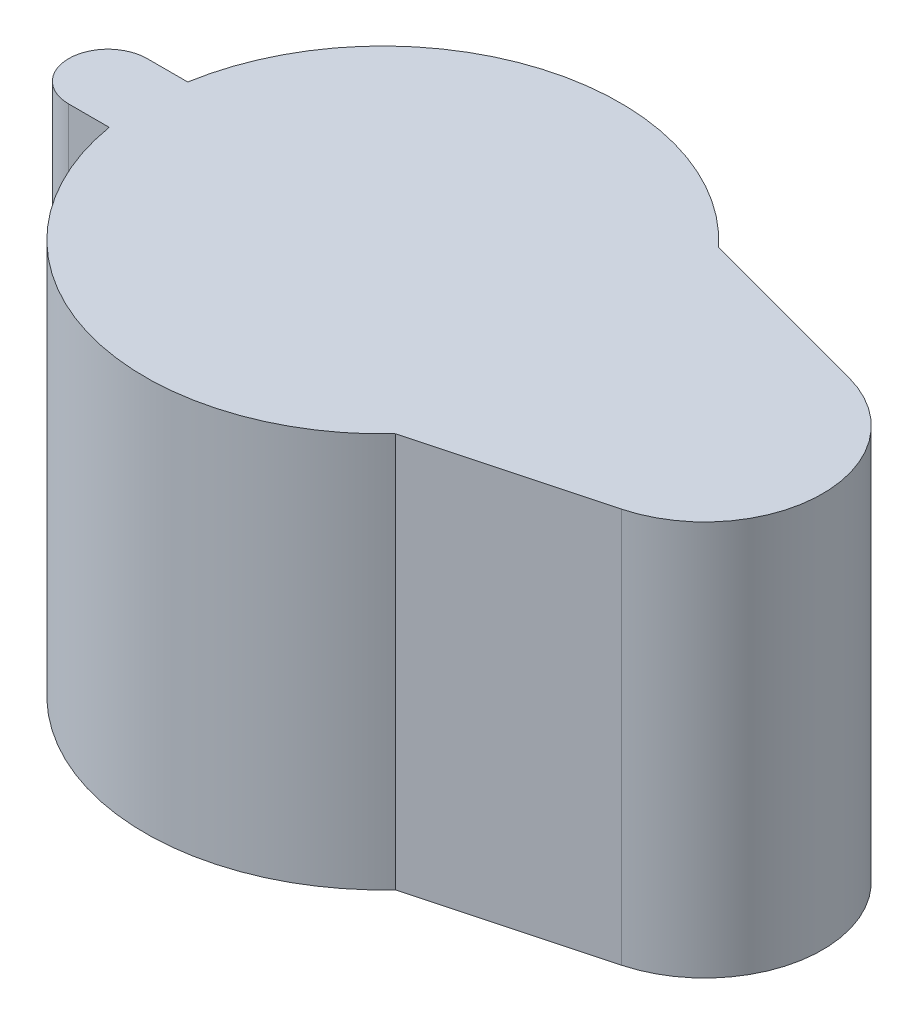
from build123d import *

# Parameters (mm, degrees)
BOSS_EXTRUDE1_DEPTH = 50.3


with BuildPart() as part:
    # Sketch1 → Boss-Extrude1 (new body)
    with BuildSketch(Plane(origin=(0, 0, 0), x_dir=(1, 0, 0), z_dir=(0, 1, 0))):
        with BuildLine():
            Line((-35, 5), (-29.833915264, 5))
            ThreePointArc((-29.833915264, 5), (-8.676624846, 28.97893513), (22.177153433, 20.572709243))
            Line((22.177153433, 20.572709243), (44.882285677, 14.488887394))
            ThreePointArc((44.882285677, 14.488887394), (56, 0), (44.882285677, -14.488887394))
            Line((44.882285677, -14.488887394), (22.177153433, -20.572709243))
            ThreePointArc((22.177153433, -20.572709243), (-8.676624846, -28.97893513), (-29.833915264, -5))
            Line((-29.833915264, -5), (-35, -5))
            ThreePointArc((-35, -5), (-40, 0), (-35, 5))
        make_face()
    extrude(amount=BOSS_EXTRUDE1_DEPTH)


solid = part.part
